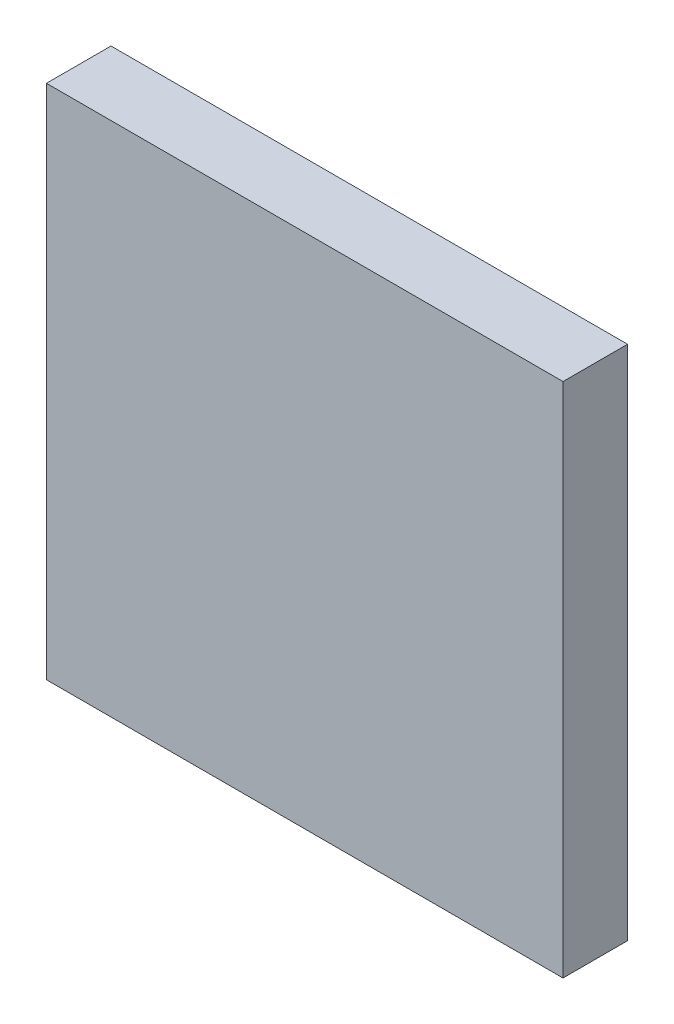
from build123d import *

# Parameters (mm, degrees)
SKETCH1_W           = 40
SKETCH1_H           = 5
BOSS_EXTRUDE1_DEPTH = 40
SKETCH2_R           = 1.5
CUT_EXTRUDE1_DEPTH  = 15


with BuildPart() as part:
    # Sketch1 → Boss-Extrude1 (new body)
    with BuildSketch(Plane(origin=(0, 0, 0), x_dir=(1, 0, 0), z_dir=(0, 1, 0))):
        Rectangle(SKETCH1_W, SKETCH1_H)
    extrude(amount=BOSS_EXTRUDE1_DEPTH)

    # Sketch2 → Cut-Extrude1 (cut)
    with BuildSketch(Plane.XZ):
        with Locations(Location((-12, 0, 0), (0, 0, 270))):
            Circle(SKETCH2_R)
        with Locations(Location((12, 0, 0), (0, 0, 270))):
            Circle(SKETCH2_R)
    extrude(amount=-CUT_EXTRUDE1_DEPTH, mode=Mode.SUBTRACT)


solid = part.part
